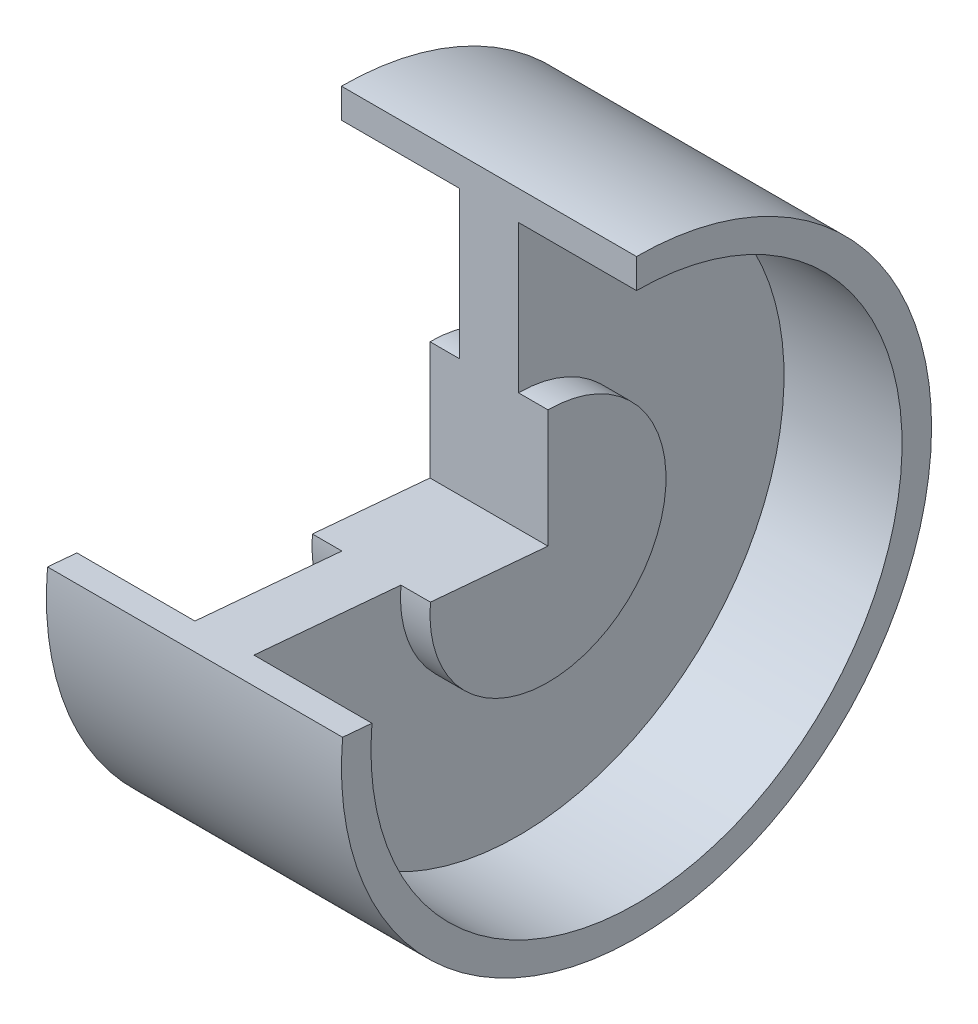
from build123d import *

# Parameters (mm, degrees)
REVOLVE1_ANGLE = 275


with BuildPart() as part:
    # Sketch1 → Revolve1 (revolve)
    with BuildSketch(Plane.XY):
        Polygon((-10, 0), (10, 0), (10, 20), (5, 20), (5, 45), (25, 45), (25, 50), (-25, 50), (-25, 45), (-5, 45), (-5, 20), (-10, 20), align=None)
    revolve(axis=Axis((0, 0, 0), (-1, 0, 0)), revolution_arc=REVOLVE1_ANGLE)


solid = part.part
